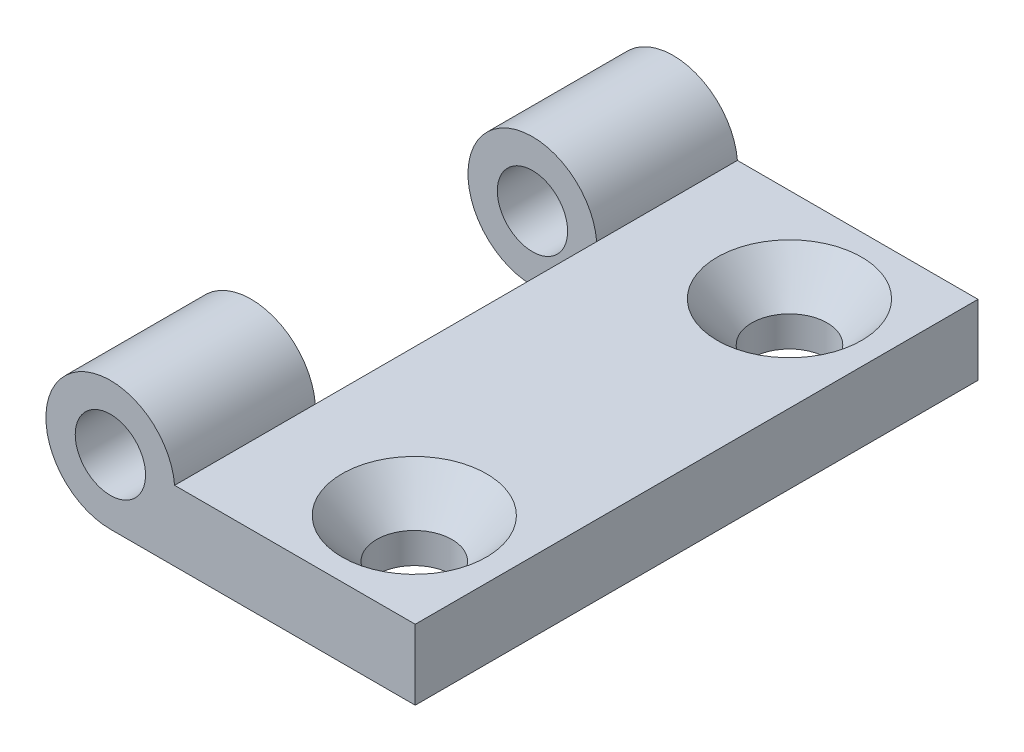
from build123d import *

# Parameters (mm, degrees)
SKETCH1_R                                    = 2.38125
EXTRUDE1_DEPTH                               = 19.05
CSK_FOR_10_FLAT_HEAD_MACHINE_SCREW1_AT_COUNT = 2
CSK_FOR_10_FLAT_HEAD_MACHINE_SCREW1_AT_PITCH = 25.4
CUT_EXTRUDE1_DEPTH                           = 19.05


with BuildPart() as part:
    # Sketch1 → Extrude1 (new, symmetric)
    with BuildSketch(Plane.XY):
        with BuildLine():
            Line((4.348688447, 4.7498), (20.6375, 4.7498))
            Line((20.6375, 4.7498), (20.6375, 0))
            Line((20.6375, 0), (0, 0))
            ThreePointArc((0, 0), (-3.219925902, 1.417615701), (-4.348688447, 4.7498))
            ThreePointArc((-4.348688447, 4.7498), (0, 8.73125), (4.348688447, 4.7498))
        make_face()
        with Locations(Location((0, 4.365625, 0), (0, 0, 180))):
            Circle(SKETCH1_R, mode=Mode.SUBTRACT)
    extrude(amount=EXTRUDE1_DEPTH, both=True)

    # Sketch6 → CSK for #10 Flat Head Machine Screw1 (revolve, cut)
    with BuildSketch(Plane(origin=(14.224, 4.7498, 12.7), x_dir=(0, 0, 1), z_dir=(1, 0, 0))):
        Polygon((0, 0), (0, 4.7498), (2.5527, 4.7498), (2.5527, 2.688180894), (4.8895, 0), align=None)
    csk_for_10_flat_head_machine_screw1 = revolve(axis=Axis((14.224, 11.0998, 12.7), (0, -1, 0)), mode=Mode.SUBTRACT)

    # CSK for #10 Flat Head Machine Screw1 at: CSK for #10 Flat Head Machine Screw1 ×2
    with Locations(*[(0, 0, -i * CSK_FOR_10_FLAT_HEAD_MACHINE_SCREW1_AT_PITCH) for i in range(1, CSK_FOR_10_FLAT_HEAD_MACHINE_SCREW1_AT_COUNT)]):
        add(csk_for_10_flat_head_machine_screw1, mode=Mode.SUBTRACT)

    # Sketch8 → Cut-Extrude1 (cut)
    with BuildSketch(Plane(origin=(0, 0, -9.525), x_dir=(-1, 0, 0), z_dir=(0, 0, -1))):
        with BuildLine():
            ThreePointArc((-4.348688447, 4.7498), (-3.219925902, 1.417615701), (0, 0))
            ThreePointArc((0, 0), (3.219925902, 7.313634299), (-4.348688447, 4.7498))
        make_face()
    extrude(amount=-CUT_EXTRUDE1_DEPTH, mode=Mode.SUBTRACT)


solid = part.part
